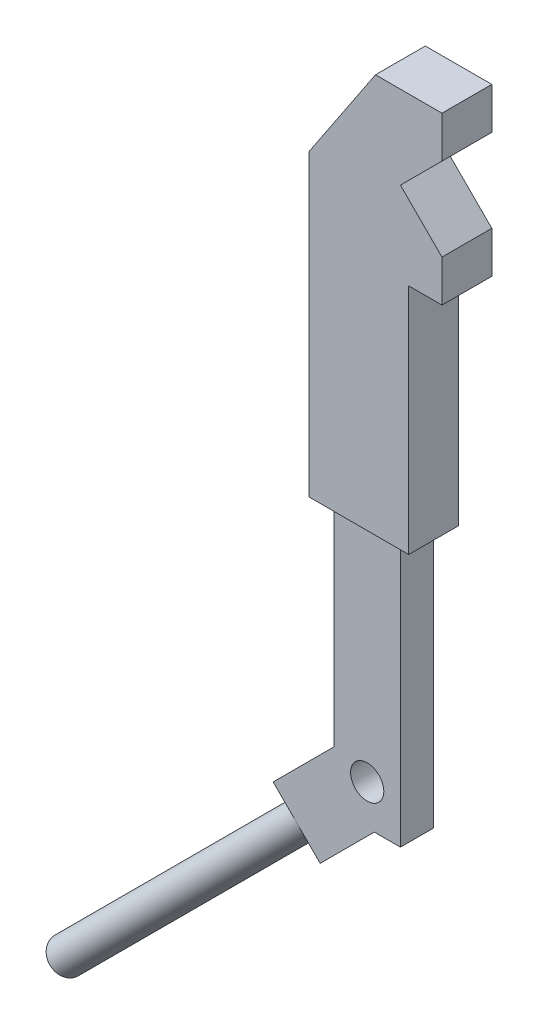
from build123d import *

# Parameters (mm, degrees)
SKETCH1_W           = 20
SKETCH1_H           = 80
SKETCH1_R           = 5
BOSS_EXTRUDE1_DEPTH = 5
BOSS_EXTRUDE2_DEPTH = 7.5
BOSS_EXTRUDE3_DEPTH = 5
SKETCH4_R           = 5
BOSS_EXTRUDE4_DEPTH = 105


with BuildPart() as part:
    # Sketch1 → Boss-Extrude1 (new, symmetric)
    with BuildSketch(Plane.XY):
        with Locations((0, 40)):
            Rectangle(SKETCH1_W, SKETCH1_H)
        with Locations((0, 12)):
            Circle(SKETCH1_R, mode=Mode.SUBTRACT)
    extrude(amount=BOSS_EXTRUDE1_DEPTH, both=True)

    # Sketch2 → Boss-Extrude2 (add, symmetric)
    with BuildSketch(Plane.XY):
        Polygon((-15, 80), (-15, 170), (5, 200), (25, 200), (25, 187.5), (12.5, 175), (25, 162.5), (25, 150), (15, 150), (15, 80), align=None)
    extrude(amount=BOSS_EXTRUDE2_DEPTH, both=True)

    # Sketch3 → Boss-Extrude3 (add, symmetric)
    with BuildSketch(Plane.XY):
        with BuildLine():
            Line((-7.071067812, 19.071067812), (-28.284271247, -2.142135624))
            Line((-28.284271247, -2.142135624), (-14.142135624, -16.284271247))
            Line((-14.142135624, -16.284271247), (7.071067812, 4.928932188))
            Line((7.071067812, 4.928932188), (3.535533906, 8.464466094))
            ThreePointArc((3.535533906, 8.464466094), (-3.535533906, 8.464466094), (-3.535533906, 15.535533906))
            Line((-3.535533906, 15.535533906), (-7.071067812, 19.071067812))
        make_face()
    extrude(amount=BOSS_EXTRUDE3_DEPTH, both=True)

    # Sketch4 → Boss-Extrude4 (add)
    with BuildSketch(Plane(origin=(-15.213203436, -15.213203436, 0), x_dir=(0, 0, 1), z_dir=(-0.7071067811865512, -0.7071067811865438, 0))):
        with Locations(Location((0, 8.485281374, 0), (0, 0, 180))):
            Circle(SKETCH4_R)
    extrude(amount=BOSS_EXTRUDE4_DEPTH)


solid = part.part
